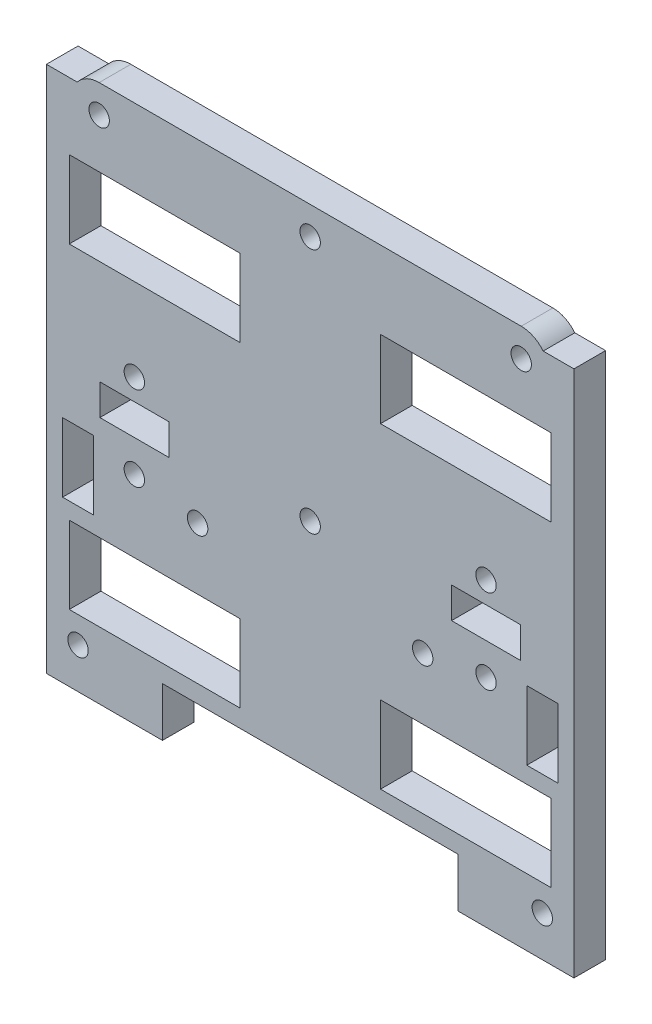
from build123d import *

# Parameters (mm, degrees)
SKETCH1_W            = 95
SKETCH1_H            = 75
SKETCH1_W_2          = 24.25
SKETCH1_H_2          = 11
BOSS_EXTRUDE1_DEPTH  = 4.5
SKETCH2_R            = 1.45
SCREWHOLES_DEPTH     = 61.685665523
SKETCH4_R            = 1.45
SKETCH4_W            = 9.8
SKETCH4_H            = 4.4
CUT_EXTRUDE3_DEPTH   = 61.685665523
SKETCH5_R            = 1.45
SKETCH5_W            = 4.4
SKETCH5_H            = 9.8
CUT_EXTRUDE4_DEPTH   = 61.685665523
SKETCH9_R            = 4
SKETCH9_R_2          = 1.45
BOSS_EXTRUDE3_DEPTH  = 4.5
SKETCH10_W           = 10
SKETCH10_H           = 75
CUT_EXTRUDE5_DEPTH   = 62.623859016
BOSS_EXTRUDE4_DEPTH  = 4.5
SKETCH12_R           = 1.45
FANBRACESCREWS_DEPTH = 55.290883213
SKETCH13_W           = 42
SKETCH13_H           = 14
CUT_EXTRUDE7_DEPTH   = 55.290883213
SKETCH15_R           = 1.45
BELTCLIPSCREWS_DEPTH = 55.290883213


with BuildPart() as part:
    # Sketch1 → Boss-Extrude1 (new body)
    with BuildSketch(Plane.XY):
        Rectangle(SKETCH1_W, SKETCH1_H)
        with Locations((-22.125, 22.5)):
            Rectangle(SKETCH1_W_2, SKETCH1_H_2, mode=Mode.SUBTRACT)
        with Locations((22.125, 22.5)):
            Rectangle(SKETCH1_W_2, SKETCH1_H_2, mode=Mode.SUBTRACT)
        with Locations((22.125, -22.5)):
            Rectangle(SKETCH1_W_2, SKETCH1_H_2, mode=Mode.SUBTRACT)
        with Locations((-22.125, -22.5)):
            Rectangle(SKETCH1_W_2, SKETCH1_H_2, mode=Mode.SUBTRACT)
    extrude(amount=BOSS_EXTRUDE1_DEPTH)

    # Sketch2 → screwHoles (cut, through all)
    with BuildSketch(Plane.XY.offset(4.5)):
        with Locations((-30, 35)):
            Circle(SKETCH2_R)
        with Locations(Location((30, 35, 0), (0, 0, 180))):
            Circle(SKETCH2_R)
        with Locations((40, 0)):
            Circle(SKETCH2_R)
        with Locations(Location((-40, 0, 0), (0, 0, 180))):
            Circle(SKETCH2_R)
        with Locations((0, 35)):
            Circle(SKETCH2_R)
    extrude(amount=-SCREWHOLES_DEPTH, mode=Mode.SUBTRACT)

    # Sketch4 → Cut-Extrude3 (cut, through all)
    with BuildSketch(Plane.XY.offset(4.5)):
        Circle(SKETCH4_R)
        with Locations((-25, 0)):
            Rectangle(SKETCH4_W, SKETCH4_H)
        with Locations((25, 0)):
            Rectangle(SKETCH4_W, SKETCH4_H)
    extrude(amount=-CUT_EXTRUDE3_DEPTH, mode=Mode.SUBTRACT)

    # Sketch5 → Cut-Extrude4 (cut, through all)
    with BuildSketch(Plane.XY.offset(4.5)):
        with Locations((33, -31.75)):
            Circle(SKETCH5_R)
        with Locations(Location((-33, -31.75, 0), (0, 0, 180))):
            Circle(SKETCH5_R)
        with Locations((33, -9.75)):
            Rectangle(SKETCH5_W, SKETCH5_H)
        with Locations((-33, -9.75)):
            Rectangle(SKETCH5_W, SKETCH5_H)
    extrude(amount=-CUT_EXTRUDE4_DEPTH, mode=Mode.SUBTRACT)

    # Sketch9 → Boss-Extrude3 (add, through all)
    # profile 1 of 2: a face of its own
    with BuildSketch(Plane.XY.offset(4.5)):
        with Locations((-30, 35)):
            Circle(SKETCH9_R)
        with Locations((-30, 35)):
            Circle(SKETCH9_R_2, mode=Mode.SUBTRACT)
    # profile 2 of 2: a face of its own
    with BuildSketch(Plane.XY.offset(4.5)):
        with Locations((30, 35)):
            Circle(SKETCH9_R)
        with Locations(Location((30, 35, 0), (0, 0, 180))):
            Circle(SKETCH9_R_2, mode=Mode.SUBTRACT)
    extrude(amount=-BOSS_EXTRUDE3_DEPTH)

    # Sketch10 → Cut-Extrude5 (cut, through all)
    with BuildSketch(Plane.XY.offset(4.5)):
        with Locations((-42.5, 0)):
            Rectangle(SKETCH10_W, SKETCH10_H)
        with Locations((42.5, 0)):
            Rectangle(SKETCH10_W, SKETCH10_H)
    extrude(amount=-CUT_EXTRUDE5_DEPTH, mode=Mode.SUBTRACT)

    # Sketch11 → Boss-Extrude4 (add, through all)
    with BuildSketch(Plane.XY.offset(4.5)):
        Polygon((-30, 39), (30, 39), (26.877501001, 37.5), (-26.877501001, 37.5), align=None)
    extrude(amount=-BOSS_EXTRUDE4_DEPTH)

    # Sketch12 → FanBraceScrews (cut, through all)
    with BuildSketch(Plane.XY.offset(4.5)):
        with Locations((-16, -8.25)):
            Circle(SKETCH12_R)
        with Locations(Location((16, -8.25, 0), (0, 0, 180))):
            Circle(SKETCH12_R)
    extrude(amount=-FANBRACESCREWS_DEPTH, mode=Mode.SUBTRACT)

    # Sketch13 → Cut-Extrude7 (cut, through all)
    with BuildSketch(Plane.XY.offset(4.5)):
        with Locations((0, -37.5)):
            Rectangle(SKETCH13_W, SKETCH13_H)
    extrude(amount=-CUT_EXTRUDE7_DEPTH, mode=Mode.SUBTRACT)

    # Sketch15 → BeltClipScrews (cut, through all)
    with BuildSketch(Plane.XY.offset(4.5)):
        with Locations((-25, 5.25)):
            Circle(SKETCH15_R)
        with Locations((-25, -6.75)):
            Circle(SKETCH15_R)
        with Locations(Location((25, -6.75, 0), (0, 0, 180))):
            Circle(SKETCH15_R)
        with Locations(Location((25, 5.25, 0), (0, 0, 180))):
            Circle(SKETCH15_R)
    extrude(amount=-BELTCLIPSCREWS_DEPTH, mode=Mode.SUBTRACT)


solid = part.part
